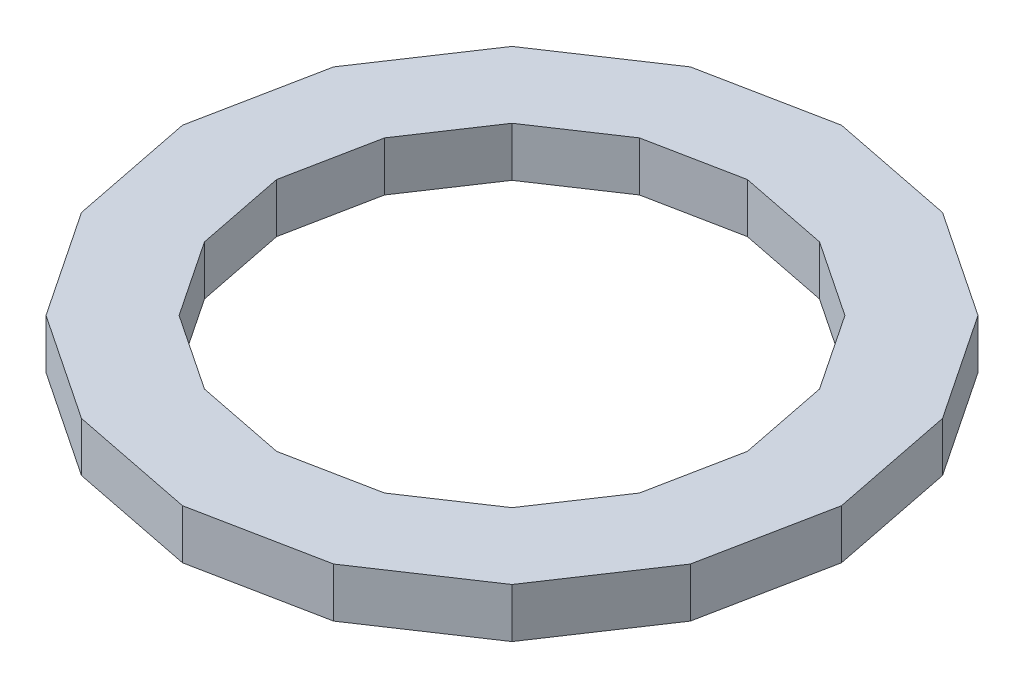
from build123d import *

# Parameters (mm, degrees)
BOSS_EXTRUDE1_DEPTH = 19.05


with BuildPart() as part:
    # Sketch1 → Boss-Extrude1 (new body)
    with BuildSketch(Plane(origin=(0, 0, 0), x_dir=(1, 0, 0), z_dir=(0, 1, 0))):
        Polygon((126.941202127, 0), (117.278378477, 48.578294938), (89.760984836, 89.760984836), (48.578294938, 117.278378477), (0, 126.941202127), (-48.578294938, 117.278378477), (-89.760984836, 89.760984836), (-117.278378477, 48.578294938), (-126.941202127, 0), (-117.278378477, -48.578294938), (-89.760984836, -89.760984836), (-48.578294938, -117.278378477), (0, -126.941202127), (48.578294938, -117.278378477), (89.760984836, -89.760984836), (117.278378477, -48.578294938), align=None)
        Polygon((90.684540541, 0), (83.781590921, 34.703471237), (64.123653565, 64.123653565), (34.703471237, 83.781590921), (0, 90.684540541), (-34.703471237, 83.781590921), (-64.123653565, 64.123653565), (-83.781590921, 34.703471237), (-90.684540541, 0), (-83.781590921, -34.703471237), (-64.123653565, -64.123653565), (-34.703471237, -83.781590921), (0, -90.684540541), (34.703471237, -83.781590921), (64.123653565, -64.123653565), (83.781590921, -34.703471237), align=None, mode=Mode.SUBTRACT)
    extrude(amount=BOSS_EXTRUDE1_DEPTH)


solid = part.part
